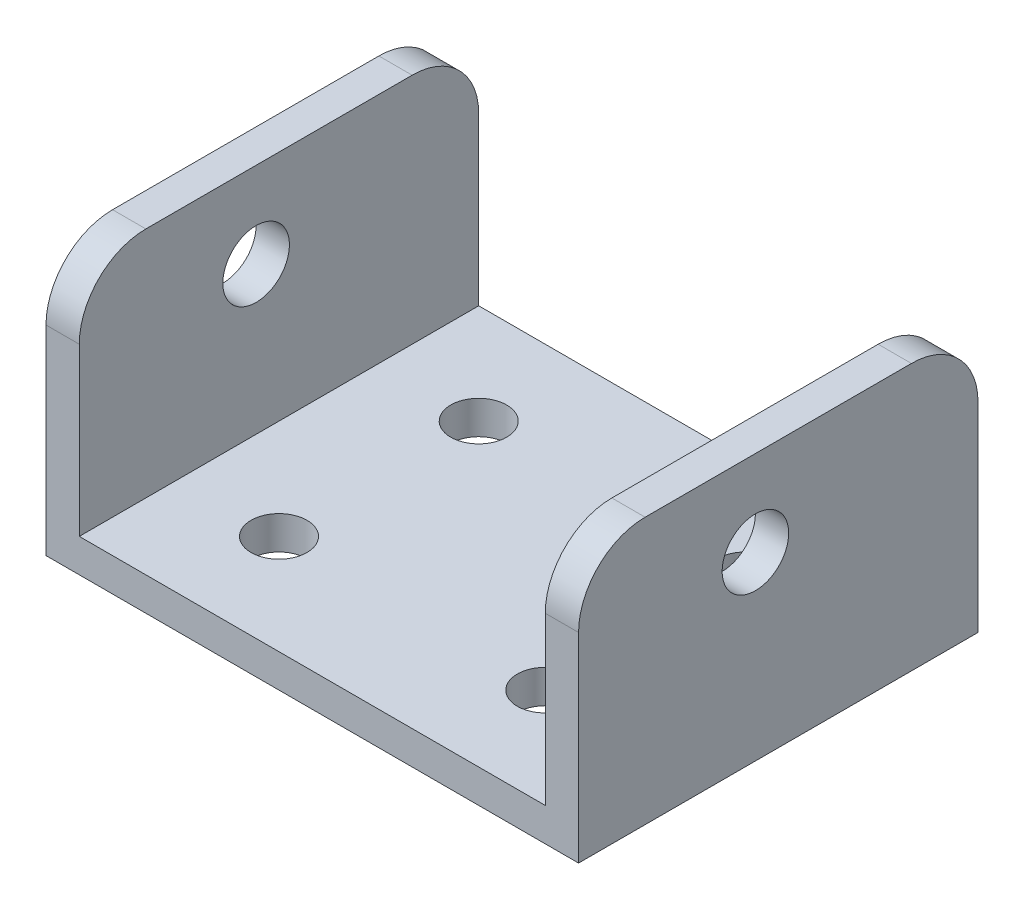
from build123d import *

# Parameters (mm, degrees)
BOSS_EXTRUDE1_DEPTH = 38.1
SKETCH2_R           = 3.175
CUT_EXTRUDE1_DEPTH  = 65.757547823
CUT_EXTRUDE2_REACH  = 52.899
SKETCH3_R           = 2.667
FILLET1_R           = 6.35


with BuildPart() as part:
    # Sketch1 → Boss-Extrude1 (new body)
    with BuildSketch(Plane.XY):
        Polygon((-22.225, -9.525), (-22.225, 12.7), (-25.4, 12.7), (-25.4, -12.7), (25.4, -12.7), (25.4, 12.7), (22.225, 12.7), (22.225, -9.525), align=None)
    extrude(amount=BOSS_EXTRUDE1_DEPTH)

    # Sketch2 → Cut-Extrude1 (cut, through all)
    with BuildSketch(Plane.ZY.offset(25.4)):
        with Locations((21.233208268, 4.543167929)):
            Circle(SKETCH2_R)
    extrude(amount=-CUT_EXTRUDE1_DEPTH, mode=Mode.SUBTRACT)

    # Sketch3 → Cut-Extrude2 (cut, up to next)
    with BuildSketch(Plane(origin=(0, -9.525, 0), x_dir=(1, 0, 0), z_dir=(0, 1, 0)), mode=Mode.PRIVATE) as cut_extrude2_sk1:
        with Locations(Location((12.7, -9.525, 0), (0, 0, 270))):
            Circle(SKETCH3_R)
    cut_extrude2_tool1 = extrude(cut_extrude2_sk1.sketch, amount=-CUT_EXTRUDE2_REACH, mode=Mode.PRIVATE) & part.part
    # Sketch3 → Cut-Extrude2 (cut, up to next)
    with BuildSketch(Plane(origin=(0, -9.525, 0), x_dir=(1, 0, 0), z_dir=(0, 1, 0)), mode=Mode.PRIVATE) as cut_extrude2_sk2:
        with Locations(Location((12.7, -28.575, 0), (0, 0, 270))):
            Circle(SKETCH3_R)
    cut_extrude2_tool2 = extrude(cut_extrude2_sk2.sketch, amount=-CUT_EXTRUDE2_REACH, mode=Mode.PRIVATE) & part.part
    # Sketch3 → Cut-Extrude2 (cut, up to next)
    with BuildSketch(Plane(origin=(0, -9.525, 0), x_dir=(1, 0, 0), z_dir=(0, 1, 0)), mode=Mode.PRIVATE) as cut_extrude2_sk3:
        with Locations(Location((-12.7, -28.575, 0), (0, 0, 270))):
            Circle(SKETCH3_R)
    cut_extrude2_tool3 = extrude(cut_extrude2_sk3.sketch, amount=-CUT_EXTRUDE2_REACH, mode=Mode.PRIVATE) & part.part
    # Sketch3 → Cut-Extrude2 (cut, up to next)
    with BuildSketch(Plane(origin=(0, -9.525, 0), x_dir=(1, 0, 0), z_dir=(0, 1, 0)), mode=Mode.PRIVATE) as cut_extrude2_sk4:
        with Locations(Location((-12.7, -9.525, 0), (0, 0, 270))):
            Circle(SKETCH3_R)
    cut_extrude2_tool4 = extrude(cut_extrude2_sk4.sketch, amount=-CUT_EXTRUDE2_REACH, mode=Mode.PRIVATE) & part.part
    add(cut_extrude2_tool1.solids().sort_by_distance((12.7, -9.525, 9.525))[0], mode=Mode.SUBTRACT)
    add(cut_extrude2_tool2.solids().sort_by_distance((12.7, -9.525, 28.575))[0], mode=Mode.SUBTRACT)
    add(cut_extrude2_tool3.solids().sort_by_distance((-12.7, -9.525, 28.575))[0], mode=Mode.SUBTRACT)
    add(cut_extrude2_tool4.solids().sort_by_distance((-12.7, -9.525, 9.525))[0], mode=Mode.SUBTRACT)

    # Fillet1
    fillet1_edges = [part.edges().sort_by_distance(p)[0] for p in [
        (-23.8125, 12.7, 38.1),
        (23.8125, 12.7, 38.1),
        (23.8125, 12.7, 0),
        (-23.8125, 12.7, 0),
    ]]
    fillet(fillet1_edges, radius=FILLET1_R)


solid = part.part
